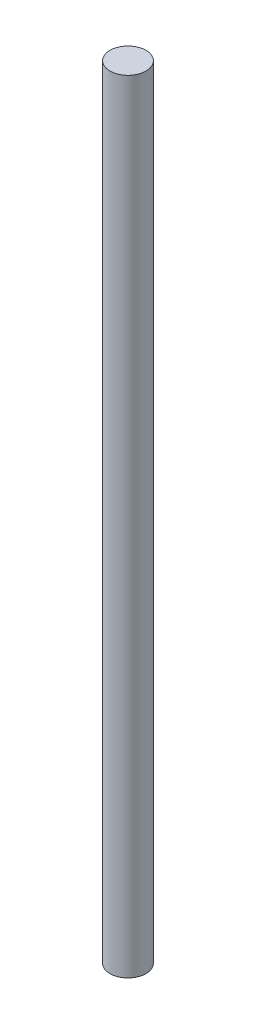
from build123d import *

# Parameters (mm, degrees)
SKETCH1_R           = 1.59
BOSS_EXTRUDE1_DEPTH = 69.15


with BuildPart() as part:
    # Sketch1 → Boss-Extrude1 (new body)
    with BuildSketch(Plane(origin=(0, 0, 0), x_dir=(1, 0, 0), z_dir=(0, 1, 0))):
        with Locations(Location((0, 0, 0), (0, 0, 270))):
            Circle(SKETCH1_R)
    extrude(amount=BOSS_EXTRUDE1_DEPTH)


solid = part.part
